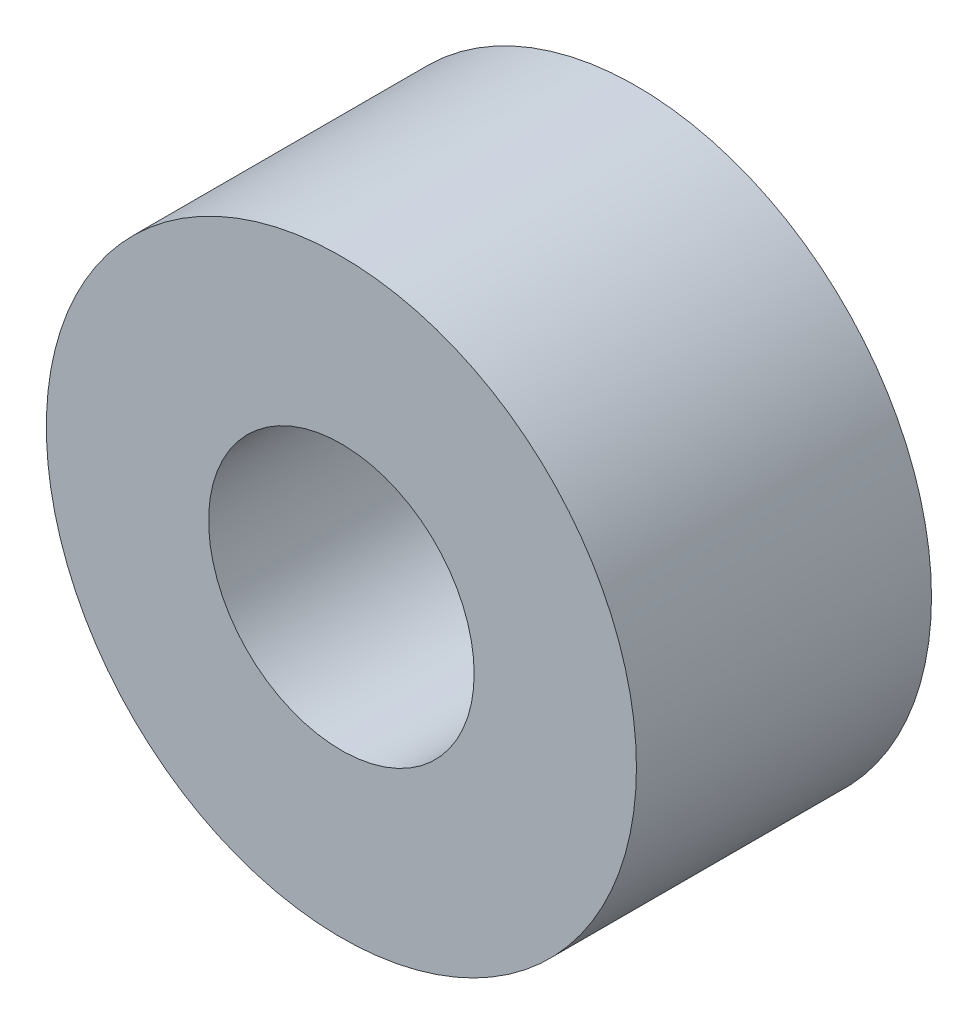
from build123d import *

# Parameters (mm, degrees)
SKETCH2_R           = 5
SKETCH2_R_2         = 2.25
BOSS_EXTRUDE1_DEPTH = 5


with BuildPart() as part:
    # Sketch2 → Boss-Extrude1 (new body)
    with BuildSketch(Plane.XY):
        Circle(SKETCH2_R)
        Circle(SKETCH2_R_2, mode=Mode.SUBTRACT)
    extrude(amount=BOSS_EXTRUDE1_DEPTH)


solid = part.part
